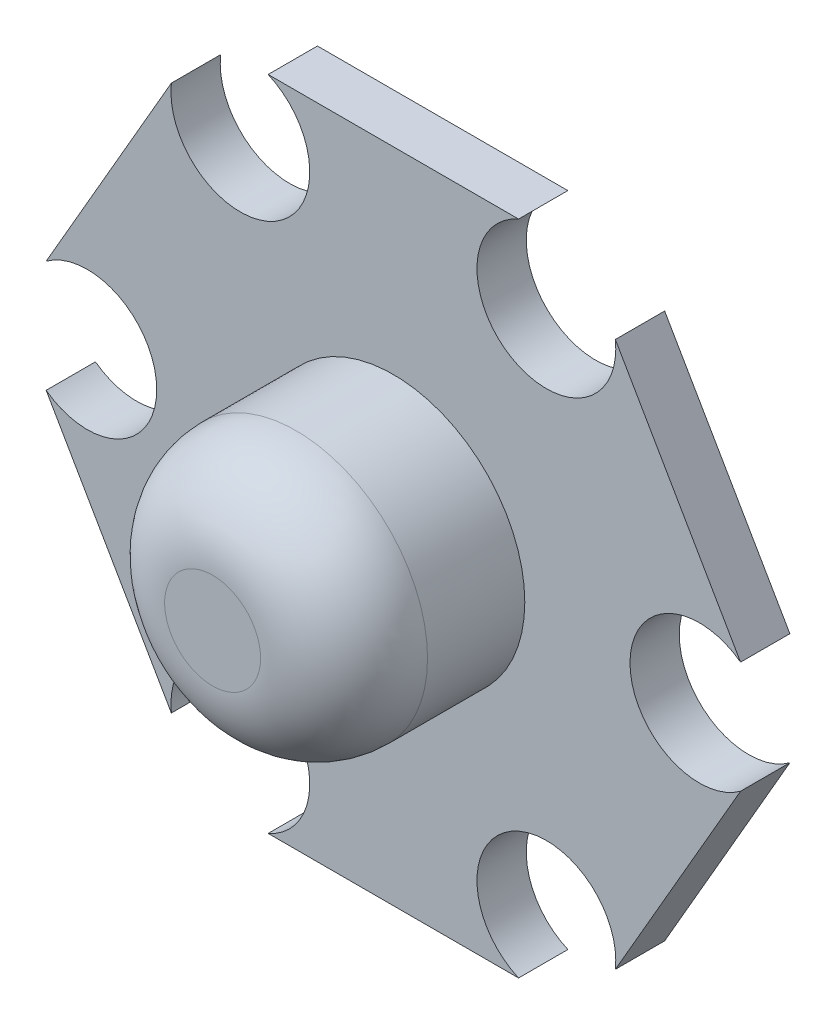
from build123d import *

# Parameters (mm, degrees)
BOSS_EXTRUDE1_DEPTH = 1.5
SKETCH2_R           = 4
BOSS_EXTRUDE2_DEPTH = 5.5
FILLET1_R           = 2.54


with BuildPart() as part:
    # Sketch1 → Boss-Extrude1 (new body)
    with BuildSketch(Plane.XY):
        with BuildLine():
            Line((-3.81, 10), (3.81, 10))
            ThreePointArc((3.81, 10), (3.6, 6.235382907), (6.755254038, 8.299556788))
            Line((6.755254038, 8.299556788), (10.565254038, 1.700443212))
            ThreePointArc((10.565254038, 1.700443212), (7.2, 0), (10.565254038, -1.700443212))
            Line((10.565254038, -1.700443212), (6.755254038, -8.299556788))
            ThreePointArc((6.755254038, -8.299556788), (3.6, -6.235382907), (3.81, -10))
            Line((3.81, -10), (-3.81, -10))
            ThreePointArc((-3.81, -10), (-3.6, -6.235382907), (-6.755254038, -8.299556788))
            Line((-6.755254038, -8.299556788), (-10.565254038, -1.700443212))
            ThreePointArc((-10.565254038, -1.700443212), (-7.2, 0), (-10.565254038, 1.700443212))
            Line((-10.565254038, 1.700443212), (-6.755254038, 8.299556788))
            ThreePointArc((-6.755254038, 8.299556788), (-3.6, 6.235382907), (-3.81, 10))
        make_face()
    extrude(amount=BOSS_EXTRUDE1_DEPTH)

    # Sketch2 → Boss-Extrude2 (add)
    with BuildSketch(Plane.XY.offset(1.5)):
        Circle(SKETCH2_R)
    extrude(amount=BOSS_EXTRUDE2_DEPTH)

    # Fillet1
    fillet1_edges = [part.edges().sort_by_distance(p)[0] for p in [
        (-4, 0, 7),
    ]]
    fillet(fillet1_edges, radius=FILLET1_R)


solid = part.part
